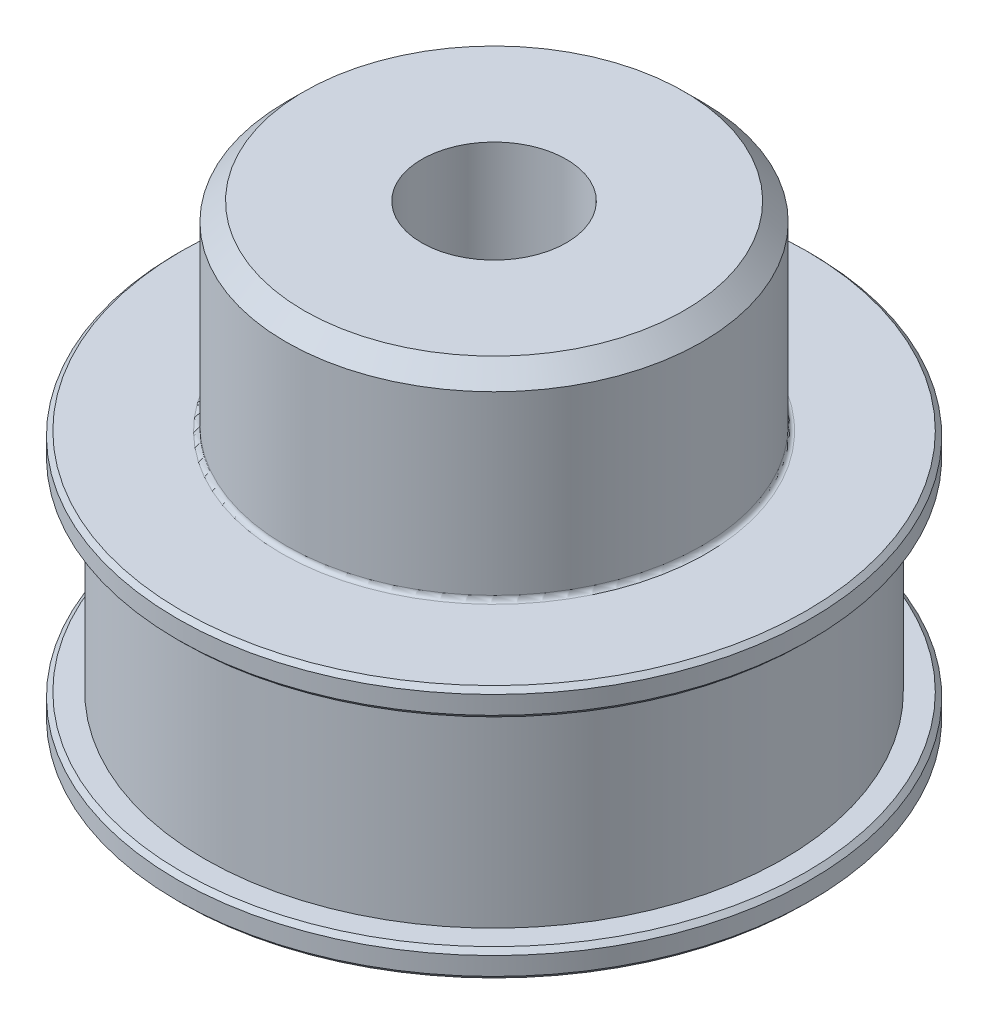
from build123d import *

# Parameters (mm, degrees)
SKETCH1_R               = 17.5
BOSS_EXTRUDE1_DEPTH     = 1.5
SKETCH2_R               = 16
BOSS_EXTRUDE2_DEPTH     = 11
SKETCH3_R               = 17.5
BOSS_EXTRUDE3_DEPTH     = 1.5
SKETCH4_R               = 11.5
BOSS_EXTRUDE4_DEPTH     = 11
CUT_EXTRUDE1_DEPTH      = 36.178118199
CUT_EXTRUDE1_DEPTH_BACK = 36.178118199
SKETCH6_R               = 4
CHAMFER1_SIZE           = 1
CHAMFER2_SIZE           = 0.25
FILLET1_R               = 0.25


with BuildPart() as part:
    # Sketch1 → Boss-Extrude1 (new body)
    with BuildSketch(Plane(origin=(0, 0, 0), x_dir=(1, 0, 0), z_dir=(0, 1, 0))):
        with Locations(Location((0, 0, 0), (0, 0, 270))):
            Circle(SKETCH1_R)
    extrude(amount=BOSS_EXTRUDE1_DEPTH)

    # Sketch2 → Boss-Extrude2 (add)
    with BuildSketch(Plane(origin=(0, 1.5, 0), x_dir=(1, 0, 0), z_dir=(0, 1, 0))):
        with Locations(Location((0, 0, 0), (0, 0, 270))):
            Circle(SKETCH2_R)
    extrude(amount=BOSS_EXTRUDE2_DEPTH)

    # Sketch3 → Boss-Extrude3 (add)
    with BuildSketch(Plane(origin=(0, 12.5, 0), x_dir=(1, 0, 0), z_dir=(0, 1, 0))):
        with Locations(Location((0, 0, 0), (0, 0, 270))):
            Circle(SKETCH3_R)
    extrude(amount=BOSS_EXTRUDE3_DEPTH)

    # Sketch4 → Boss-Extrude4 (add)
    with BuildSketch(Plane(origin=(0, 14, 0), x_dir=(1, 0, 0), z_dir=(0, 1, 0))):
        with Locations(Location((0, 0, 0), (0, 0, 270))):
            Circle(SKETCH4_R)
    extrude(amount=BOSS_EXTRUDE4_DEPTH)

    # Sketch6 → Cut-Extrude1 (cut, two sides: drawn at the far end of the back side and taken through both)
    with BuildSketch(Plane(origin=(0, 25, 0), x_dir=(1, 0, 0), z_dir=(0, 1, 0)).offset(-CUT_EXTRUDE1_DEPTH_BACK)):
        with Locations(Location((0, 0, 0), (0, 0, 270))):
            Circle(SKETCH6_R)
    extrude(amount=CUT_EXTRUDE1_DEPTH + CUT_EXTRUDE1_DEPTH_BACK, mode=Mode.SUBTRACT)

    # Chamfer1
    chamfer1_edges = [part.edges().sort_by_distance(p)[0] for p in [
        (0, 25, -11.5),
    ]]
    chamfer(chamfer1_edges, length=CHAMFER1_SIZE)

    # Chamfer2
    chamfer2_edges = [part.edges().sort_by_distance(p)[0] for p in [
        (0, 0, -17.5),
        (0, 1.5, -17.5),
        (0, 12.5, -17.5),
        (0, 14, -17.5),
    ]]
    chamfer(chamfer2_edges, length=CHAMFER2_SIZE)

    # Fillet1
    fillet1_edges = [part.edges().sort_by_distance(p)[0] for p in [
        (0, 14, -11.5),
    ]]
    fillet(fillet1_edges, radius=FILLET1_R)


solid = part.part
